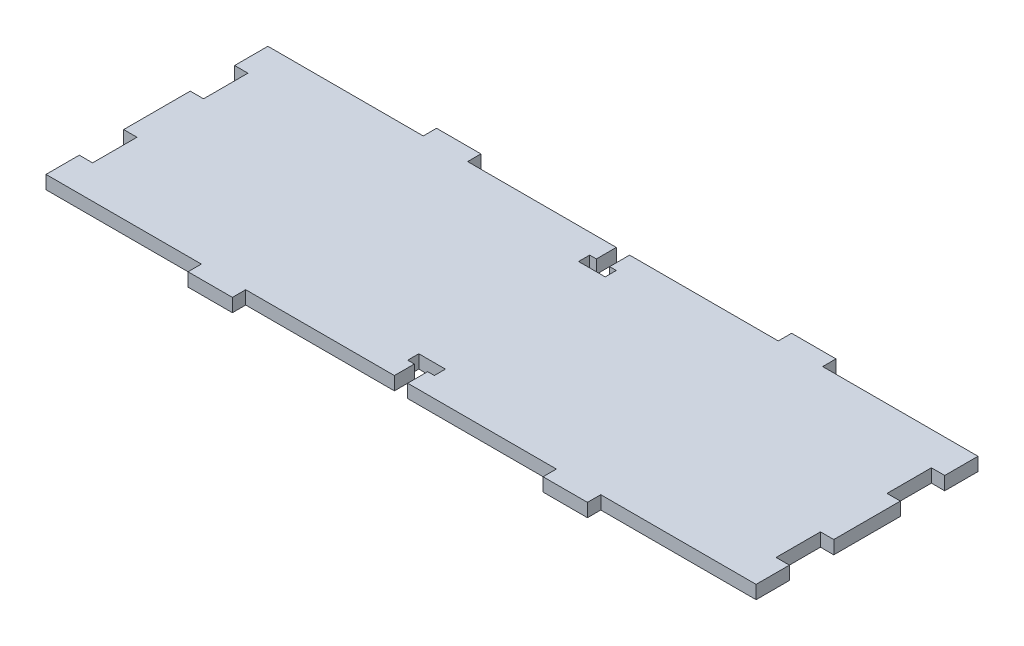
from build123d import *

# Parameters (mm, degrees)
SKETCH3_W           = 160
SKETCH3_H           = 56
BOSS_EXTRUDE1_DEPTH = 3
SKETCH4_W           = 3
SKETCH4_H           = 10
SKETCH4_W_2         = 35
SKETCH4_H_2         = 3
CUT_EXTRUDE1_DEPTH  = 85.811555816


with BuildPart() as part:
    # Sketch3 → Boss-Extrude1 (new body)
    with BuildSketch(Plane(origin=(0, 0, 0), x_dir=(1, 0, 0), z_dir=(0, 1, 0))):
        Rectangle(SKETCH3_W, SKETCH3_H)
    extrude(amount=BOSS_EXTRUDE1_DEPTH)

    # Sketch4 → Cut-Extrude1 (cut, through all)
    with BuildSketch(Plane(origin=(0, 3, 0), x_dir=(1, 0, 0), z_dir=(0, 1, 0))):
        with Locations((-78.5, 12.5)):
            Rectangle(SKETCH4_W, SKETCH4_H)
        Polygon((-35, 28), (-35, 25), (-1.5, 25), (-1.5, 20.5), (-3, 20.5), (-3, 18), (3, 18), (3, 20.5), (1.5, 20.5), (1.5, 25), (35, 25), (35, 28), align=None)
        with Locations((-62.5, 26.5)):
            Rectangle(SKETCH4_W_2, SKETCH4_H_2)
        with Locations((62.5, 26.5)):
            Rectangle(SKETCH4_W_2, SKETCH4_H_2)
        with Locations((78.5, 12.5)):
            Rectangle(SKETCH4_W, SKETCH4_H)
        with Locations((78.5, -12.5)):
            Rectangle(SKETCH4_W, SKETCH4_H)
        with Locations((62.5, -26.5)):
            Rectangle(SKETCH4_W_2, SKETCH4_H_2)
        Polygon((35, -28), (-35, -28), (-35, -25), (-1.5, -25), (-1.5, -20.5), (-3, -20.5), (-3, -18), (3, -18), (3, -20.5), (1.5, -20.5), (1.5, -25), (35, -25), align=None)
        with Locations((-62.5, -26.5)):
            Rectangle(SKETCH4_W_2, SKETCH4_H_2)
        with Locations((-78.5, -12.5)):
            Rectangle(SKETCH4_W, SKETCH4_H)
    extrude(amount=-CUT_EXTRUDE1_DEPTH, mode=Mode.SUBTRACT)


solid = part.part
